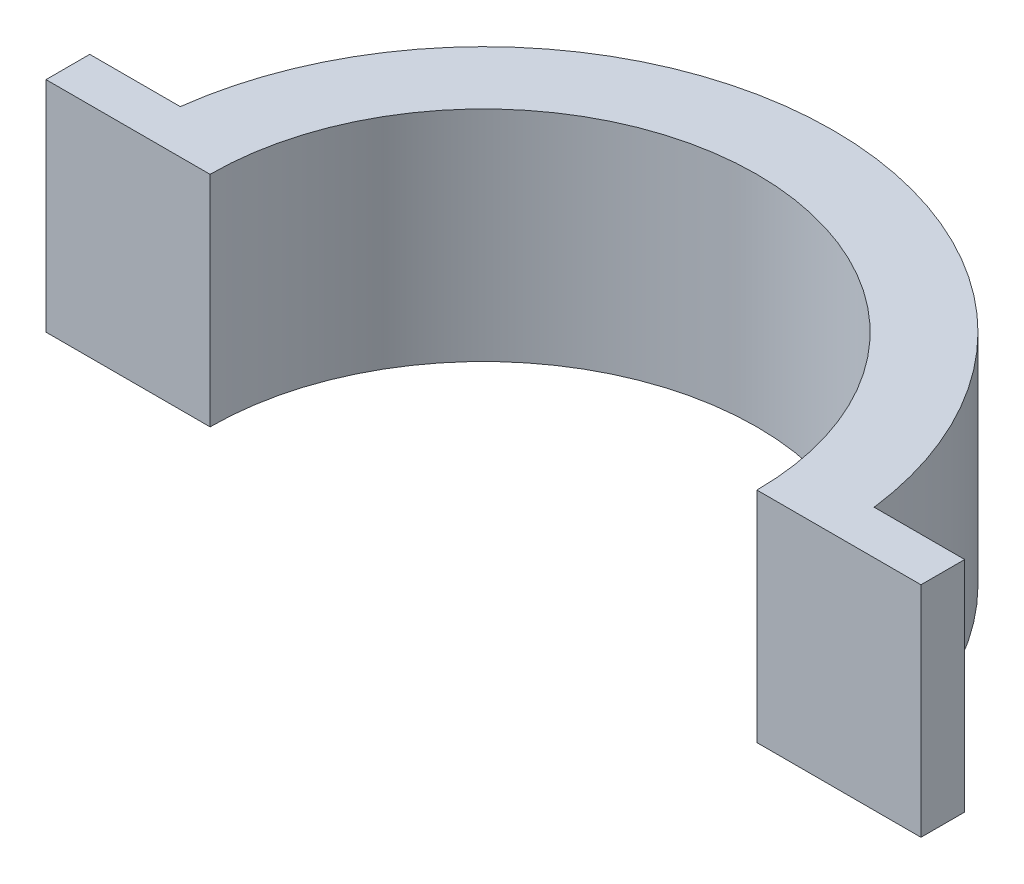
from build123d import *

# Parameters (mm, degrees)
BOSS_EXTRUDE1_DEPTH = 10


with BuildPart() as part:
    # Sketch1 → Boss-Extrude1 (new body)
    with BuildSketch(Plane(origin=(0, 0, 0), x_dir=(1, 0, 0), z_dir=(0, 1, 0))):
        with BuildLine():
            Line((-20, 0), (-15.985928344, 0))
            ThreePointArc((-15.985928344, 0), (-15.954496575, 1.001970088), (-15.860324871, 2))
            Line((-15.860324871, 2), (-19.202832359, 2))
            Line((-19.202832359, 2), (-20, 2))
            Line((-20, 2), (-20, 0))
        make_face()
        with BuildLine():
            Line((-15.985928344, 0), (-12.5, 0))
            ThreePointArc((-12.5, 0), (0, 12.5), (12.5, 0))
            Line((12.5, 0), (15.985928344, 0))
            ThreePointArc((15.985928344, 0), (15.954496575, 1.001970088), (15.860324871, 2))
            ThreePointArc((15.860324871, 2), (0, 15.985928344), (-15.860324871, 2))
            ThreePointArc((-15.860324871, 2), (-15.954496575, 1.001970088), (-15.985928344, 0))
        make_face()
        with BuildLine():
            ThreePointArc((15.860324871, 2), (15.954496575, 1.001970088), (15.985928344, 0))
            Line((15.985928344, 0), (20, 0))
            Line((20, 0), (20, 2))
            Line((20, 2), (19.202832359, 2))
            Line((19.202832359, 2), (15.860324871, 2))
        make_face()
    extrude(amount=BOSS_EXTRUDE1_DEPTH)


solid = part.part
